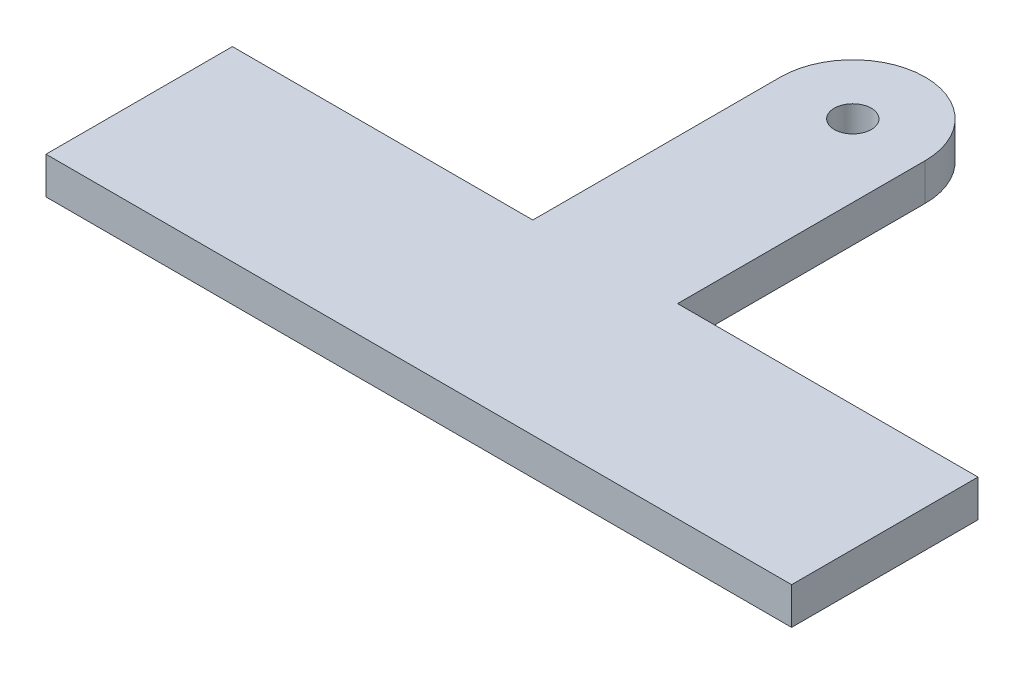
from build123d import *

# Parameters (mm, degrees)
SKETCH1_R           = 1.27
BOSS_EXTRUDE1_DEPTH = 1.27


with BuildPart() as part:
    # Sketch1 → Boss-Extrude1 (new, symmetric)
    with BuildSketch(Plane(origin=(0, 0, 0), x_dir=(1, 0, 0), z_dir=(0, 1, 0))):
        with BuildLine():
            Line((4.963813713, 0), (25.565066873, 0))
            Line((25.565066873, 0), (25.565066873, -12.782533436))
            Line((25.565066873, -12.782533436), (-25.565066873, -12.782533436))
            Line((-25.565066873, -12.782533436), (-25.565066873, 0))
            Line((-25.565066873, 0), (-4.963813713, 0))
            Line((-4.963813713, 0), (-4.963813713, 16.980141079))
            ThreePointArc((-4.963813713, 16.980141079), (0, 21.943954793), (4.963813713, 16.980141079))
            Line((4.963813713, 16.980141079), (4.963813713, 0))
        make_face()
        with Locations(Location((0, 16.980141079, 0), (0, 0, 270))):
            Circle(SKETCH1_R, mode=Mode.SUBTRACT)
    extrude(amount=BOSS_EXTRUDE1_DEPTH, both=True)


solid = part.part
